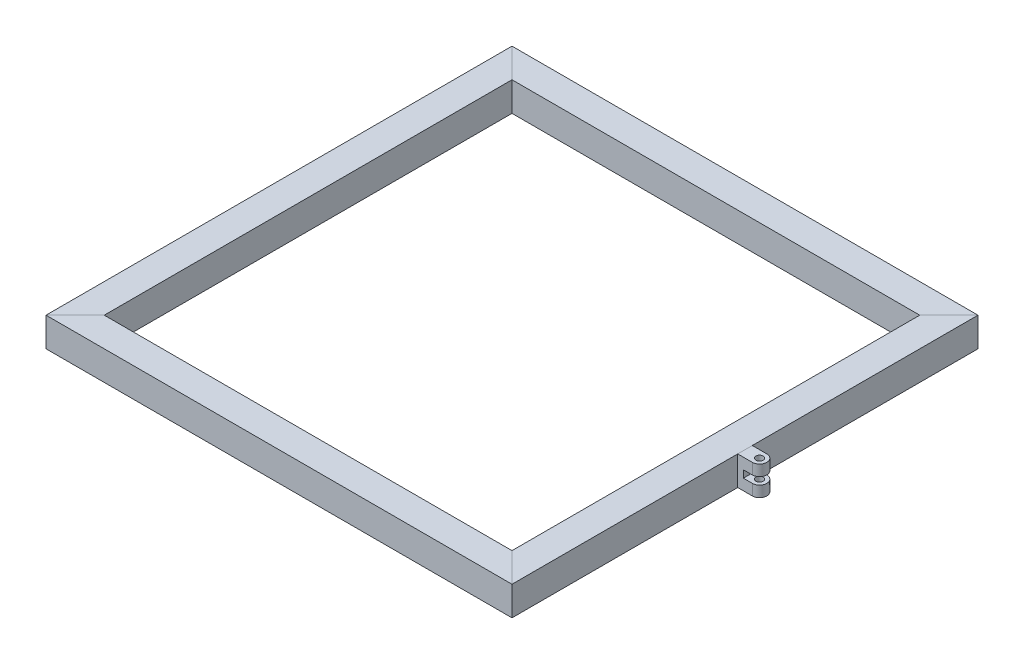
from build123d import *

# Parameters (mm, degrees)
TUBO_CUADRADO_20_X_20_X_2_2_DEPTH      = 315.142135624
TUBO_CUADRADO_20_X_20_X_2_2_DEPTH_BACK = 15.142135624
SKETCH1_W                              = 20
SKETCH1_H                              = 20
SKETCH1_W_2                            = 16
SKETCH1_H_2                            = 16
SKETCH1_ON_SEGMENT_2_W                 = 20
SKETCH1_ON_SEGMENT_2_H                 = 20
SKETCH1_ON_SEGMENT_2_W_2               = 16
SKETCH1_ON_SEGMENT_2_H_2               = 16
TUBO_CUADRADO_20_X_20_X_2_2_2_DEPTH    = 330.284271247
SKETCH1_ON_SEGMENT_3_W                 = 20
SKETCH1_ON_SEGMENT_3_H                 = 20
SKETCH1_ON_SEGMENT_3_W_2               = 16
SKETCH1_ON_SEGMENT_3_H_2               = 16
TUBO_CUADRADO_20_X_20_X_2_2_3_DEPTH    = 330.284271247
SKETCH1_ON_SEGMENT_4_W                 = 20
SKETCH1_ON_SEGMENT_4_H                 = 20
SKETCH1_ON_SEGMENT_4_W_2               = 16
SKETCH1_ON_SEGMENT_4_H_2               = 16
TUBO_CUADRADO_20_X_20_X_2_2_4_DEPTH    = 330.284271247
CROQUIS7_R                             = 2.5
SALIENTE_EXTRUIR1_DEPTH                = 20
CROQUIS8_W                             = 15.105602269
CROQUIS8_H                             = 5
CORTAR_EXTRUIR1_DEPTH                  = 80


with BuildPart() as part:
    # Sketch1 → Tubo cuadrado 20 X 20 X 2(2) (new, two sides: drawn at the far end of the back side and taken through both)
    with BuildSketch(Plane(origin=(-150, 0, -150), x_dir=(1, 0, 0), z_dir=(0, 0, 1)).offset(-TUBO_CUADRADO_20_X_20_X_2_2_DEPTH_BACK)):
        Rectangle(SKETCH1_W, SKETCH1_H)
        Rectangle(SKETCH1_W_2, SKETCH1_H_2, mode=Mode.SUBTRACT)
    extrude(amount=TUBO_CUADRADO_20_X_20_X_2_2_DEPTH + TUBO_CUADRADO_20_X_20_X_2_2_DEPTH_BACK)

    # Tubo cuadrado 20 X 20 X 2(2) mitre 1
    split(bisect_by=Plane(origin=(-150, 0, -150), x_dir=(0, -1, 0), z_dir=(-0.707106781, 0, 0.707106781)), keep=Keep.TOP)

    # Tubo cuadrado 20 X 20 X 2(2) mitre 2
    split(bisect_by=Plane(origin=(-150, 0, 150), x_dir=(0, -1, 0), z_dir=(-0.707106781, 0, -0.707106781)), keep=Keep.TOP)


with BuildPart() as body_2:
    # Sketch1 on segment 2 (carried to segment 2) → Tubo cuadrado 20 X 20 X 2_2 2 (new body)
    with BuildSketch(Plane(origin=(-165.142135624, 0, 150), x_dir=(0, 0, -1), z_dir=(1, 0, 0))):
        Rectangle(SKETCH1_ON_SEGMENT_2_W, SKETCH1_ON_SEGMENT_2_H)
        Rectangle(SKETCH1_ON_SEGMENT_2_W_2, SKETCH1_ON_SEGMENT_2_H_2, mode=Mode.SUBTRACT)
    extrude(amount=TUBO_CUADRADO_20_X_20_X_2_2_2_DEPTH)

    # Tubo cuadrado 20 X 20 X 2_2 2 mitre 1
    split(bisect_by=Plane(origin=(-150, 0, 150), x_dir=(0, 1, 0), z_dir=(0.707106781, 0, 0.707106781)), keep=Keep.TOP)

    # Tubo cuadrado 20 X 20 X 2_2 2 mitre 2
    split(bisect_by=Plane(origin=(150, 0, 150), x_dir=(0, -1, 0), z_dir=(-0.707106781, 0, 0.707106781)), keep=Keep.TOP)


with BuildPart() as body_3:
    # Sketch1 on segment 3 (carried to segment 3) → Tubo cuadrado 20 X 20 X 2_2 3 (new body)
    with BuildSketch(Plane(origin=(150, 0, 165.142135624), x_dir=(-1, 0, 0), z_dir=(0, 0, -1))):
        Rectangle(SKETCH1_ON_SEGMENT_3_W, SKETCH1_ON_SEGMENT_3_H)
        Rectangle(SKETCH1_ON_SEGMENT_3_W_2, SKETCH1_ON_SEGMENT_3_H_2, mode=Mode.SUBTRACT)
    extrude(amount=TUBO_CUADRADO_20_X_20_X_2_2_3_DEPTH)

    # Tubo cuadrado 20 X 20 X 2_2 3 mitre 1
    split(bisect_by=Plane(origin=(150, 0, -150), x_dir=(0, 1, 0), z_dir=(0.707106781, 0, 0.707106781)), keep=Keep.TOP)

    # Tubo cuadrado 20 X 20 X 2_2 3 mitre 2
    split(bisect_by=Plane(origin=(150, 0, 150), x_dir=(0, 1, 0), z_dir=(0.707106781, 0, -0.707106781)), keep=Keep.TOP)


with BuildPart() as body_4:
    # Sketch1 on segment 4 (carried to segment 4) → Tubo cuadrado 20 X 20 X 2_2 4 (new body)
    with BuildSketch(Plane(origin=(165.142135624, 0, -150), x_dir=(0, 0, 1), z_dir=(-1, 0, 0))):
        Rectangle(SKETCH1_ON_SEGMENT_4_W, SKETCH1_ON_SEGMENT_4_H)
        Rectangle(SKETCH1_ON_SEGMENT_4_W_2, SKETCH1_ON_SEGMENT_4_H_2, mode=Mode.SUBTRACT)
    extrude(amount=TUBO_CUADRADO_20_X_20_X_2_2_4_DEPTH)

    # Tubo cuadrado 20 X 20 X 2_2 4 mitre 1
    split(bisect_by=Plane(origin=(-150, 0, -150), x_dir=(0, 1, 0), z_dir=(0.707106781, 0, -0.707106781)), keep=Keep.TOP)

    # Tubo cuadrado 20 X 20 X 2_2 4 mitre 2
    split(bisect_by=Plane(origin=(150, 0, -150), x_dir=(0, -1, 0), z_dir=(-0.707106781, 0, -0.707106781)), keep=Keep.TOP)


with BuildPart() as body_5:
    # Croquis7 → Saliente-Extruir1 (new body)
    with BuildSketch(Plane(origin=(0, 10, 0), x_dir=(1, 0, 0), z_dir=(0, 1, 0))):
        with BuildLine():
            Line((160, 0), (160, 5))
            Line((160, 5), (170, 5))
            ThreePointArc((170, 5), (175, 0), (170, -5))
            Line((170, -5), (160, -5))
            Line((160, -5), (160, 0))
        make_face()
        with Locations(Location((170, 0, 0), (0, 0, 180))):
            Circle(CROQUIS7_R, mode=Mode.SUBTRACT)
    extrude(amount=-SALIENTE_EXTRUIR1_DEPTH)

    # Croquis8 → Cortar-Extruir1 (cut)
    with BuildSketch(Plane.XY.offset(5)):
        with Locations((171.408016387, 0)):
            Rectangle(CROQUIS8_W, CROQUIS8_H)
    extrude(amount=-CORTAR_EXTRUIR1_DEPTH, mode=Mode.SUBTRACT)


solid = Compound([part.part, body_2.part, body_3.part, body_4.part, body_5.part])
